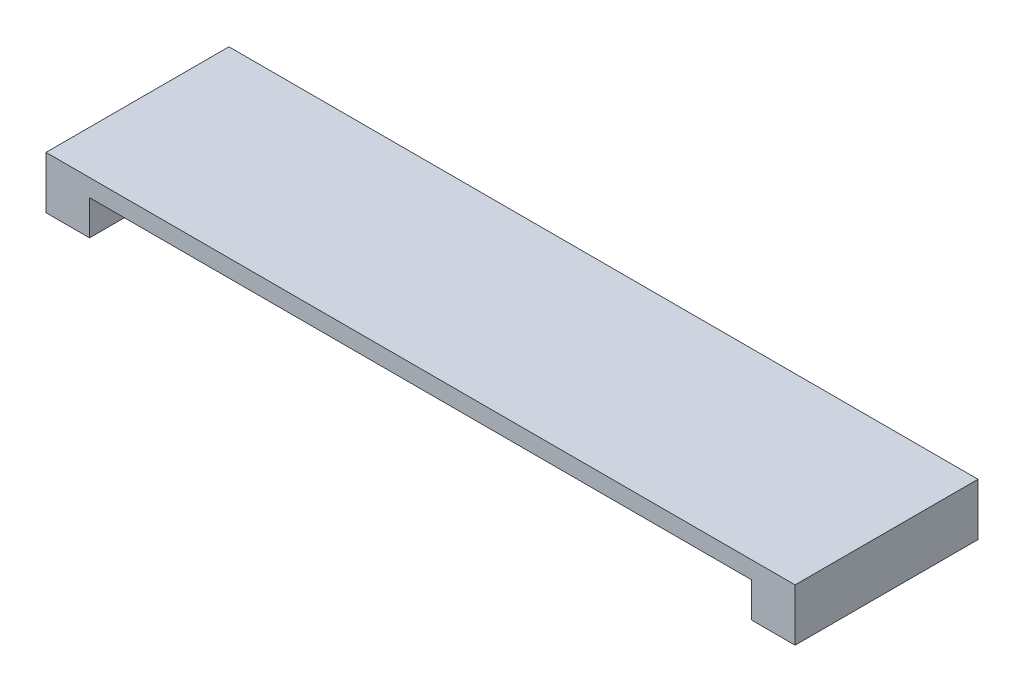
from build123d import *

# Parameters (mm, degrees)
SKETCH1_W                       = 860
SKETCH1_H                       = 210
BOSS_EXTRUDE1_DEPTH             = 20
BOSS_EXTRUDE2_REACH             = 445.086
SKETCH2_W                       = 50
SKETCH2_H                       = 40
BOSS_EXTRUDE2_DIRECTION_2_REACH = 445.086


with BuildPart() as part:
    # Sketch1 → Boss-Extrude1 (new body)
    with BuildSketch(Plane(origin=(0, 0, 0), x_dir=(1, 0, 0), z_dir=(0, 1, 0))):
        Rectangle(SKETCH1_W, SKETCH1_H)
    extrude(amount=BOSS_EXTRUDE1_DEPTH)

    # Boss-Extrude2: up to this face of the body (flat: up to its plane)
    boss_extrude2_end = Plane(part.part.faces().sort_by_distance((0, 10, 105))[0])
    # Sketch2 → Boss-Extrude2 (add, up to the picked face)
    with BuildSketch(Plane.XY, mode=Mode.PRIVATE) as boss_extrude2_sk1:
        with Locations((-405, -20)):
            Rectangle(SKETCH2_W, SKETCH2_H)
    boss_extrude2_tool1 = split(extrude(boss_extrude2_sk1.sketch, amount=BOSS_EXTRUDE2_REACH, mode=Mode.PRIVATE), bisect_by=boss_extrude2_end, keep=Keep.BOTH, mode=Mode.PRIVATE)
    # Sketch2 → Boss-Extrude2 (add, up to the picked face)
    with BuildSketch(Plane.XY, mode=Mode.PRIVATE) as boss_extrude2_sk2:
        with Locations((405, -20)):
            Rectangle(SKETCH2_W, SKETCH2_H)
    boss_extrude2_tool2 = split(extrude(boss_extrude2_sk2.sketch, amount=BOSS_EXTRUDE2_REACH, mode=Mode.PRIVATE), bisect_by=boss_extrude2_end, keep=Keep.BOTH, mode=Mode.PRIVATE)
    add(boss_extrude2_tool1.solids().sort_by(Axis((-405, -20, 0), (0, 0, 1)))[0])
    add(boss_extrude2_tool2.solids().sort_by(Axis((405, -20, 0), (0, 0, 1)))[0])

    # Boss-Extrude2 direction 2: up to this face of the body (flat: up to its plane)
    boss_extrude2_direction_2_end = Plane(part.part.faces().sort_by_distance((0, 10, -105))[0])
    # Sketch2 → Boss-Extrude2 direction 2 (add, up to the picked face)
    with BuildSketch(Plane.XY, mode=Mode.PRIVATE) as boss_extrude2_direction_2_sk1:
        with Locations((-405, -20)):
            Rectangle(SKETCH2_W, SKETCH2_H)
    boss_extrude2_direction_2_tool1 = split(extrude(boss_extrude2_direction_2_sk1.sketch, amount=-BOSS_EXTRUDE2_DIRECTION_2_REACH, mode=Mode.PRIVATE), bisect_by=boss_extrude2_direction_2_end, keep=Keep.BOTH, mode=Mode.PRIVATE)
    # Sketch2 → Boss-Extrude2 direction 2 (add, up to the picked face)
    with BuildSketch(Plane.XY, mode=Mode.PRIVATE) as boss_extrude2_direction_2_sk2:
        with Locations((405, -20)):
            Rectangle(SKETCH2_W, SKETCH2_H)
    boss_extrude2_direction_2_tool2 = split(extrude(boss_extrude2_direction_2_sk2.sketch, amount=-BOSS_EXTRUDE2_DIRECTION_2_REACH, mode=Mode.PRIVATE), bisect_by=boss_extrude2_direction_2_end, keep=Keep.BOTH, mode=Mode.PRIVATE)
    add(boss_extrude2_direction_2_tool1.solids().sort_by(Axis((-405, -20, 0), (0, 0, -1)))[0])
    add(boss_extrude2_direction_2_tool2.solids().sort_by(Axis((405, -20, 0), (0, 0, -1)))[0])


solid = part.part
